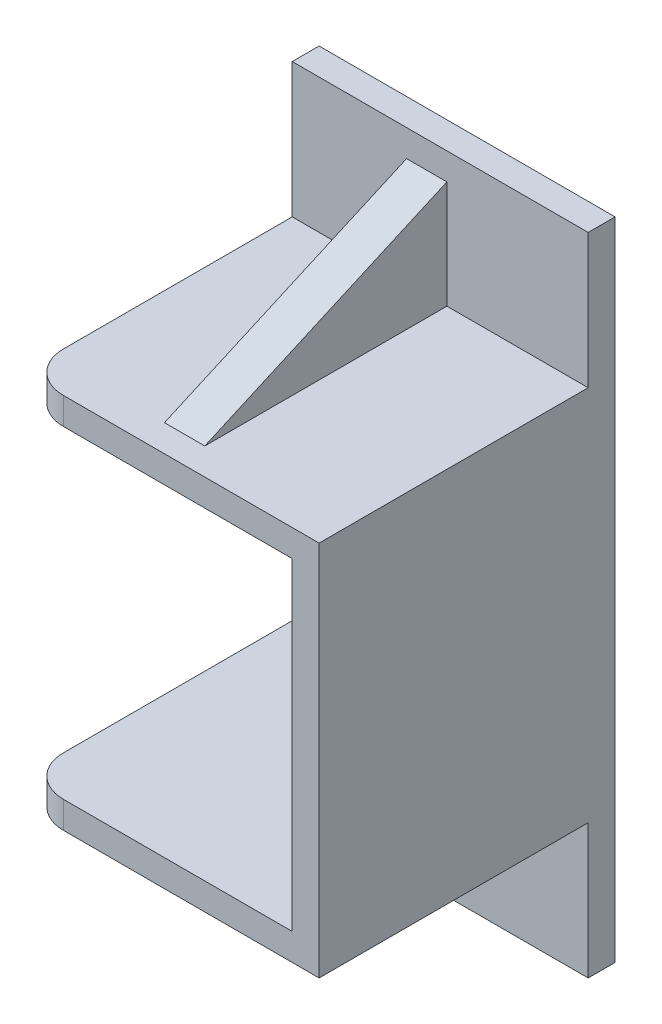
from build123d import *

# Parameters (mm, degrees)
SKETCH_2_W          = 22
SKETCH_2_H          = 28
EXTRUDE_1_DEPTH     = 22
SKETCH_3_W          = 18
SKETCH_3_H          = 24
CUT_EXTRUDE_1_DEPTH = 20
SKETCH_4_W          = 14
SKETCH_4_H          = 14
CUT_EXTRUDE_3_DEPTH = 27.776855678
SKETCH_6_W          = 20
SKETCH_6_H          = 24
CUT_EXTRUDE_4_DEPTH = 5
SKETCH_7_W          = 22
SKETCH_7_H          = 2
EXTRUDE_3_DEPTH     = 10
SKETCH_8_W          = 22
SKETCH_8_H          = 2
EXTRUDE_4_DEPTH     = 10
RIB_3_REACH         = 36.699
SKETCH_10_WALL_W    = 91.095121896
SKETCH_10_WALL_H    = 3
RIB_4_REACH         = 36.699
SKETCH_11_WALL_W    = 91.095121896
SKETCH_11_WALL_H    = 3
FILLET_1_R          = 3


with BuildPart() as part:
    # ｽｹｯﾁ2 → ﾎﾞｽ - 押し出し1 (new body)
    with BuildSketch(Plane.XY):
        Rectangle(SKETCH_2_W, SKETCH_2_H)
    extrude(amount=EXTRUDE_1_DEPTH)

    # ｽｹｯﾁ3 → ｶｯﾄ - 押し出し1 (cut)
    with BuildSketch(Plane.XY.offset(22)):
        Rectangle(SKETCH_3_W, SKETCH_3_H)
    extrude(amount=-CUT_EXTRUDE_1_DEPTH, mode=Mode.SUBTRACT)

    # ｽｹｯﾁ4 → ｶｯﾄ - 押し出し3 (cut, through all)
    with BuildSketch(Plane.XY.offset(2)):
        with Locations((-4, 0)):
            Rectangle(SKETCH_4_W, SKETCH_4_H)
    extrude(amount=-CUT_EXTRUDE_3_DEPTH, mode=Mode.SUBTRACT)

    # ｽｹｯﾁ6 → ｶｯﾄ - 押し出し4 (cut)
    with BuildSketch(Plane.ZY.offset(11)):
        with Locations((12, 0)):
            Rectangle(SKETCH_6_W, SKETCH_6_H)
    extrude(amount=-CUT_EXTRUDE_4_DEPTH, mode=Mode.SUBTRACT)

    # ｽｹｯﾁ7 → ﾎﾞｽ - 押し出し3 (add)
    with BuildSketch(Plane.XZ.offset(14)):
        with Locations((0, 1)):
            Rectangle(SKETCH_7_W, SKETCH_7_H)
    extrude(amount=EXTRUDE_3_DEPTH)

    # ｽｹｯﾁ8 → ﾎﾞｽ - 押し出し4 (add)
    with BuildSketch(Plane(origin=(0, 14, 0), x_dir=(1, 0, 0), z_dir=(0, 1, 0))):
        with Locations((0, -1)):
            Rectangle(SKETCH_8_W, SKETCH_8_H)
    extrude(amount=EXTRUDE_4_DEPTH)

    # ｽｹｯﾁ10 wall → ﾘﾌﾞ3 (add, up to next)
    with BuildSketch(Plane(origin=(-1, -18, 11), x_dir=(0, -0.406138466053, -0.91381154862), z_dir=(0, 0.91381154862, -0.406138466053)), mode=Mode.PRIVATE) as rib_3_sk1:
        Rectangle(SKETCH_10_WALL_W, SKETCH_10_WALL_H)
    rib_3_tool1 = extrude(rib_3_sk1.sketch, amount=RIB_3_REACH, mode=Mode.PRIVATE) - part.part
    add(rib_3_tool1.solids().sort_by_distance((-1, -18, 11))[0])

    # ｽｹｯﾁ11 wall → ﾘﾌﾞ4 (add, up to next)
    with BuildSketch(Plane(origin=(-1, 18, 11), x_dir=(0, 0.406138466053, -0.91381154862), z_dir=(0, 0.91381154862, 0.406138466053)), mode=Mode.PRIVATE) as rib_4_sk1:
        Rectangle(SKETCH_11_WALL_W, SKETCH_11_WALL_H)
    rib_4_tool1 = extrude(rib_4_sk1.sketch, amount=-RIB_4_REACH, mode=Mode.PRIVATE) - part.part
    add(rib_4_tool1.solids().sort_by_distance((-1, 18, 11))[0])

    # ﾌｨﾚｯﾄ1
    fillet_1_edges = [part.edges().sort_by_distance(p)[0] for p in [
        (-11, 13, 22),
        (-11, -13, 22),
    ]]
    fillet(fillet_1_edges, radius=FILLET_1_R)


solid = part.part
